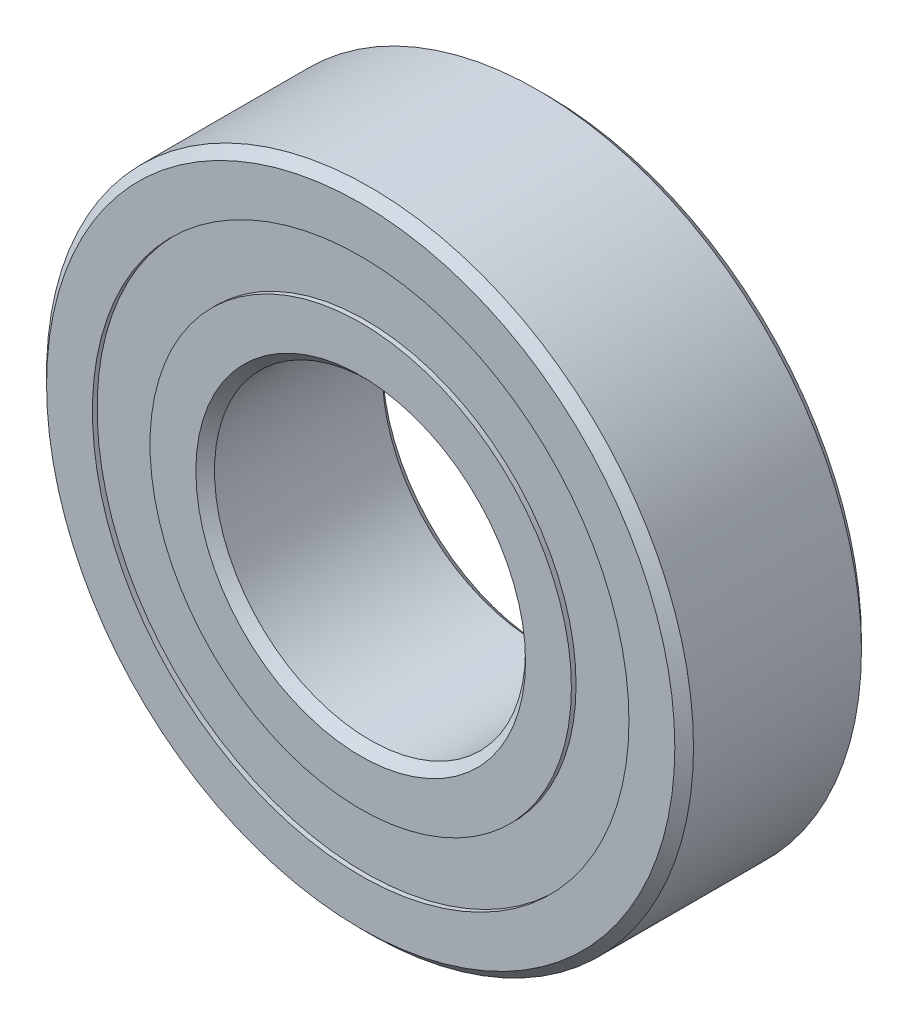
from build123d import *

# Parameters (mm, degrees)
CIRPATTERN1_COUNT = 10
SKETCH5_W         = 3.068059359
SKETCH5_H         = 4.625


with BuildPart() as part:
    # Sketch3 → Revolve1 (revolve)
    with BuildSketch(Plane(origin=(0, 0, 0), x_dir=(0, 0, -1), z_dir=(1, 0, 0)), mode=Mode.PRIVATE) as revolve1_sk:
        with BuildLine():
            Line((-7.5, 25.25), (-7.5, 21.5625))
            Line((-7.5, 21.5625), (-3.333333333, 21.5625))
            ThreePointArc((-3.333333333, 21.5625), (0, 23.306940641), (3.333333333, 21.5625))
            Line((3.333333333, 21.5625), (7.5, 21.5625))
            Line((7.5, 21.5625), (7.5, 25.25))
            Line((7.5, 25.25), (6.75, 26))
            Line((6.75, 26), (-6.75, 26))
            Line((-6.75, 26), (-7.5, 25.25))
        make_face()
        with BuildLine():
            Line((-7.5, 13.25), (-7.5, 16.9375))
            Line((-7.5, 16.9375), (-3.333333333, 16.9375))
            ThreePointArc((-3.333333333, 16.9375), (0, 15.193059359), (3.333333333, 16.9375))
            Line((3.333333333, 16.9375), (7.5, 16.9375))
            Line((7.5, 16.9375), (7.5, 13.25))
            Line((7.5, 13.25), (6.75, 12.5))
            Line((6.75, 12.5), (-6.75, 12.5))
            Line((-6.75, 12.5), (-7.5, 13.25))
        make_face()
    revolve(revolve1_sk.sketch.rotate(Axis((0, 0, 7.5), (0, 0, -1)), 90), axis=Axis((0, 0, 7.5), (0, 0, -1)))


with BuildPart() as body_2:
    # Sketch4 → Revolve2 (revolve)
    with BuildSketch(Plane(origin=(0, 0, 0), x_dir=(0, 0, -1), z_dir=(1, 0, 0))):
        with BuildLine():
            Line((-4.056940641, 19.25), (4.056940641, 19.25))
            ThreePointArc((4.056940641, 19.25), (0, 23.306940641), (-4.056940641, 19.25))
        make_face()
    revolve(axis=Axis((0, 19.25, 4.056940641), (0, 0, -1)))


with BuildPart() as cirpattern1_1:
    # CirPattern1: pattern copy
    add(body_2.part.rotate(Axis((0, 0, 0), (0, 0, 1)), 1 * 360 / CIRPATTERN1_COUNT))


with BuildPart() as cirpattern1_2:
    # CirPattern1: pattern copy
    add(body_2.part.rotate(Axis((0, 0, 0), (0, 0, 1)), 2 * 360 / CIRPATTERN1_COUNT))


with BuildPart() as cirpattern1_3:
    # CirPattern1: pattern copy
    add(body_2.part.rotate(Axis((0, 0, 0), (0, 0, 1)), 3 * 360 / CIRPATTERN1_COUNT))


with BuildPart() as cirpattern1_4:
    # CirPattern1: pattern copy
    add(body_2.part.rotate(Axis((0, 0, 0), (0, 0, 1)), 4 * 360 / CIRPATTERN1_COUNT))


with BuildPart() as cirpattern1_5:
    # CirPattern1: pattern copy
    add(body_2.part.rotate(Axis((0, 0, 0), (0, 0, 1)), 5 * 360 / CIRPATTERN1_COUNT))


with BuildPart() as cirpattern1_6:
    # CirPattern1: pattern copy
    add(body_2.part.rotate(Axis((0, 0, 0), (0, 0, 1)), 6 * 360 / CIRPATTERN1_COUNT))


with BuildPart() as cirpattern1_7:
    # CirPattern1: pattern copy
    add(body_2.part.rotate(Axis((0, 0, 0), (0, 0, 1)), 7 * 360 / CIRPATTERN1_COUNT))


with BuildPart() as cirpattern1_8:
    # CirPattern1: pattern copy
    add(body_2.part.rotate(Axis((0, 0, 0), (0, 0, 1)), 8 * 360 / CIRPATTERN1_COUNT))


with BuildPart() as cirpattern1_9:
    # CirPattern1: pattern copy
    add(body_2.part.rotate(Axis((0, 0, 0), (0, 0, 1)), 9 * 360 / CIRPATTERN1_COUNT))


with BuildPart() as body_12:
    # Sketch5 → Revolve3 (revolve)
    with BuildSketch(Plane(origin=(0, 0, 0), x_dir=(0, 0, -1), z_dir=(1, 0, 0)), mode=Mode.PRIVATE) as revolve3_sk:
        with Locations((-5.590970321, 19.25)):
            Rectangle(SKETCH5_W, SKETCH5_H)
        with Locations((5.590970321, 19.25)):
            Rectangle(SKETCH5_W, SKETCH5_H)
    revolve(revolve3_sk.sketch.rotate(Axis((0, 0, 7.5), (0, 0, -1)), 90), axis=Axis((0, 0, 7.5), (0, 0, -1)))


solid = Compound([part.part, body_2.part, cirpattern1_1.part, cirpattern1_2.part, cirpattern1_3.part, cirpattern1_4.part, cirpattern1_5.part, cirpattern1_6.part, cirpattern1_7.part, cirpattern1_8.part, cirpattern1_9.part, body_12.part])
